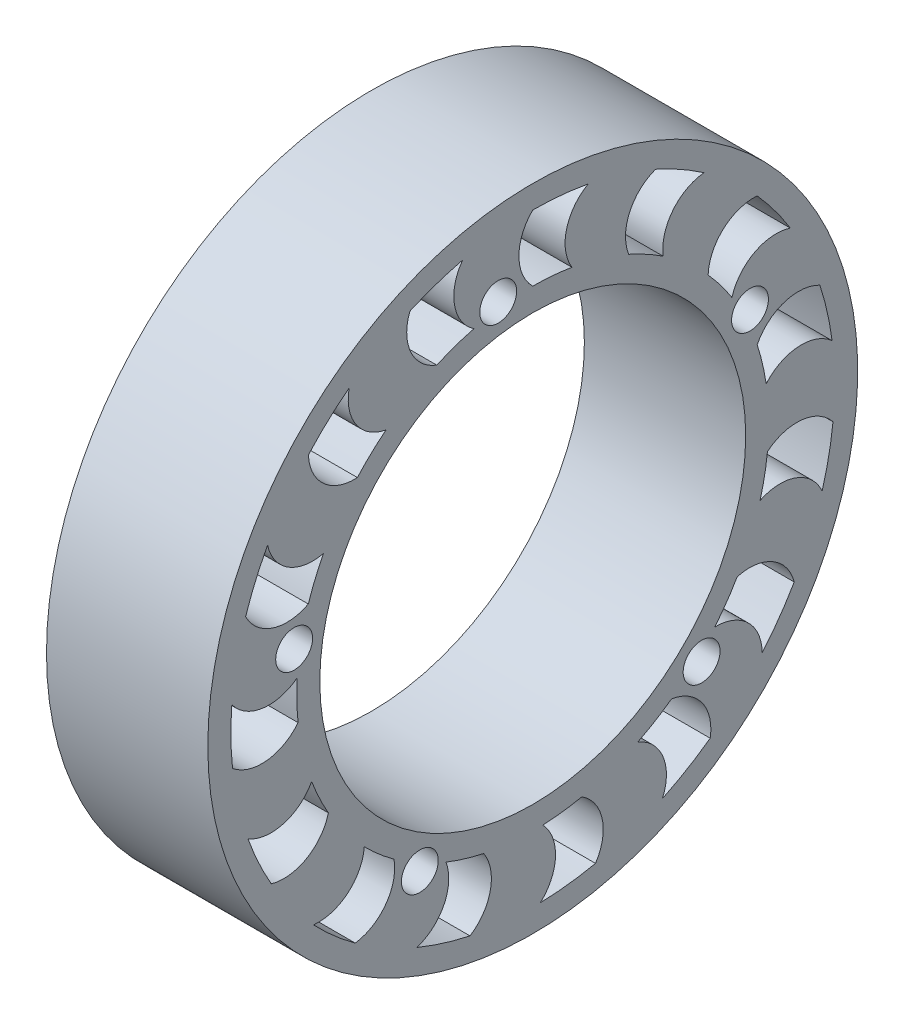
from build123d import *

# Parameters (mm, degrees)
SKETCH1_W             = 35
SKETCH1_H             = 5
SKETCH7_R             = 46.2
REINFORCEMENT_DEPTH   = 35
SKETCH8_R             = 4
INSERTS_HOLES_A_DEPTH = 12.7


with BuildPart() as part:
    # Sketch1 → Body (revolve)
    with BuildSketch(Plane(origin=(0, 0, 0), x_dir=(1, 0, 0), z_dir=(0, 1, 0)), mode=Mode.PRIVATE) as body_sk:
        with Locations((0, 68)):
            Rectangle(SKETCH1_W, SKETCH1_H)
    revolve(body_sk.sketch.rotate(Axis((-1000, 0, 0), (1, 0, 0)), 180), axis=Axis((-1000, 0, 0), (1, 0, 0)))

    # Sketch7 → Reinforcement (add)
    with BuildSketch(Plane.ZY.offset(-17.5)):
        with BuildLine():
            ThreePointArc((15.227788826, 63.705293716), (7.666591863, 65.049776089), (0, 65.5))
            ThreePointArc((0, 65.5), (3.008755476, 58.35), (0, 51.2))
            ThreePointArc((0, 51.2), (-4.264821355, 51.022066783), (-8.5, 50.48950386))
            ThreePointArc((-8.5, 50.48950386), (-7.314547286, 58.179485578), (-12, 64.391381411))
            ThreePointArc((-12, 64.391381411), (-19.454347387, 62.544211305), (-26.641250121, 59.837227476))
            ThreePointArc((-26.641250121, 59.837227476), (-20.984448226, 54.529148555), (-20.824916125, 46.773527431))
            ThreePointArc((-20.824916125, 46.773527431), (-24.648652343, 44.876318228), (-28.3010677, 42.667195444))
            ThreePointArc((-28.3010677, 42.667195444), (-30.345900107, 50.17451037), (-37.15287981, 53.943614282))
            ThreePointArc((-37.15287981, 53.943614282), (-43.211453237, 49.22418419), (-48.675986069, 43.828054717))
            ThreePointArc((-48.675986069, 43.828054717), (-41.349250191, 41.279711944), (-38.049015064, 34.259487046))
            ThreePointArc((-38.049015064, 34.259487046), (-40.770507414, 30.971046563), (-43.208623688, 27.467341316))
            ThreePointArc((-43.208623688, 27.467341316), (-48.130171117, 33.493906497), (-55.881689177, 34.168506182))
            ThreePointArc((-55.881689177, 34.168506182), (-59.496906258, 27.392848441), (-62.294201817, 20.240613132))
            ThreePointArc((-62.294201817, 20.240613132), (-54.564391152, 20.892638123), (-48.694093634, 15.821670112))
            ThreePointArc((-48.694093634, 15.821670112), (-49.842771366, 11.710599583), (-50.645016102, 7.518134342))
            ThreePointArc((-50.645016102, 7.518134342), (-57.592298291, 11.021901908), (-64.948046817, 8.485352952))
            ThreePointArc((-64.948046817, 8.485352952), (-65.494803675, 0.82504034), (-65.141184147, -6.846614344))
            ThreePointArc((-65.141184147, -6.846614344), (-58.344853181, -3.106962633), (-50.919521043, -5.351857319))
            ThreePointArc((-50.919521043, -5.351857319), (-50.29676734, -9.574716451), (-49.324425137, -13.73102636))
            ThreePointArc((-49.324425137, -13.73102636), (-57.096193882, -13.355889651), (-62.784297127, -18.664994891))
            ThreePointArc((-62.784297127, -18.664994891), (-60.168054535, -25.88542473), (-56.724663948, -32.75))
            ThreePointArc((-56.724663948, -32.75), (-52.036960049, -26.569341324), (-44.340500674, -25.6))
            ThreePointArc((-44.340500674, -25.6), (-42.05399531, -29.204477028), (-39.475192967, -32.605967862))
            ThreePointArc((-39.475192967, -32.605967862), (-46.727638847, -35.424326556), (-49.764572087, -42.587995551))
            ThreePointArc((-49.764572087, -42.587995551), (-44.437702156, -48.120064704), (-38.499934025, -52.990613132))
            ThreePointArc((-38.499934025, -52.990613132), (-36.731403783, -45.437639525), (-30.094604917, -41.421670112))
            ThreePointArc((-30.094604917, -41.421670112), (-26.539705442, -43.784518212), (-22.800341312, -45.843041305))
            ThreePointArc((-22.800341312, -45.843041305), (-28.279450549, -51.367575579), (-28.140100436, -59.14714488))
            ThreePointArc((-28.140100436, -59.14714488), (-21.023667371, -62.034308332), (-13.618215749, -64.068667848))
            ThreePointArc((-13.618215749, -64.068667848), (-15.074654109, -56.449357065), (-10.64507857, -50.081157158))
            ThreePointArc((-10.64507857, -50.081157158), (-6.436459398, -50.793818427), (-2.18310351, -51.153436435))
            ThreePointArc((-2.18310351, -51.153436435), (-4.94148834, -58.428904124), (-1.649949774, -65.479215525))
            ThreePointArc((-1.649949774, -65.479215525), (6.025550497, -65.222256487), (13.618215749, -64.068667848))
            ThreePointArc((13.618215749, -64.068667848), (9.18864021, -57.700467941), (10.64507857, -50.081157158))
            ThreePointArc((10.64507857, -50.081157158), (14.77970895, -49.020405989), (18.811612722, -47.618937691))
            ThreePointArc((18.811612722, -47.618937691), (19.250902095, -55.387344337), (25.125492192, -60.489334945))
            ThreePointArc((25.125492192, -60.489334945), (32.032895944, -57.132683969), (38.499934025, -52.990613132))
            ThreePointArc((38.499934025, -52.990613132), (31.86313516, -48.974643718), (30.094604917, -41.421670112))
            ThreePointArc((30.094604917, -41.421670112), (33.440331351, -38.770920019), (36.553630216, -35.850692016))
            ThreePointArc((36.553630216, -35.850692016), (40.114636669, -42.768809535), (47.556508301, -45.040298825))
            ThreePointArc((47.556508301, -45.040298825), (52.501462672, -39.164351358), (56.724663948, -32.75))
            ThreePointArc((56.724663948, -32.75), (49.028204573, -31.780658676), (44.340500674, -25.6))
            ThreePointArc((44.340500674, -25.6), (46.318816665, -21.817589755), (47.975192967, -17.883535998))
            ThreePointArc((47.975192967, -17.883535998), (54.042186133, -22.755159023), (61.764572087, -21.80338586))
            ThreePointArc((61.764572087, -21.80338586), (63.892049543, -14.424146601), (65.141184147, -6.846614344))
            ThreePointArc((65.141184147, -6.846614344), (57.715852009, -9.09150903), (50.919521043, -5.351857319))
            ThreePointArc((50.919521043, -5.351857319), (51.188357785, -1.091800016), (51.101409013, 3.175845861))
            ThreePointArc((51.101409013, 3.175845861), (58.625350656, 1.193065209), (65.292980245, 5.203530598))
            ThreePointArc((65.292980245, 5.203530598), (64.235120607, 12.810124142), (62.294201817, 20.240613132))
            ThreePointArc((62.294201817, 20.240613132), (56.4239043, 15.169645121), (48.694093634, 15.821670112))
            ThreePointArc((48.694093634, 15.821670112), (47.206966812, 19.822771865), (45.391727198, 23.686095119))
            ThreePointArc((45.391727198, 23.686095119), (53.071659457, 24.934997627), (57.531638952, 31.310709343))
            ThreePointArc((57.531638952, 31.310709343), (53.471355761, 37.829408046), (48.675986069, 43.828054717))
            ThreePointArc((48.675986069, 43.828054717), (45.375750942, 36.807829818), (38.049015064, 34.259487046))
            ThreePointArc((38.049015064, 34.259487046), (35.063062416, 37.309806406), (31.83340338, 40.100803349))
            ThreePointArc((31.83340338, 40.100803349), (38.341396196, 44.365442429), (39.822554625, 52.003981993))
            ThreePointArc((39.822554625, 52.003981993), (33.461907731, 56.307643628), (26.641250121, 59.837227476))
            ThreePointArc((26.641250121, 59.837227476), (26.481718021, 52.081606351), (20.824916125, 46.773527431))
            ThreePointArc((20.824916125, 46.773527431), (16.856435989, 48.34563647), (12.770794921, 49.581718376))
            ThreePointArc((12.770794921, 49.581718376), (16.981557213, 56.124699187), (15.227788826, 63.705293716))
        make_face()
        with Locations(Location((0, 0, 0), (0, 0, 180))):
            Circle(SKETCH7_R, mode=Mode.SUBTRACT)
    extrude(amount=REINFORCEMENT_DEPTH)

    # Sketch8 → Inserts_Holes_A (cut)
    with BuildSketch(Plane.ZY.offset(17.5)):
        with Locations((7.5, 52)):
            Circle(SKETCH8_R)
        with Locations((51.772566305, 8.935959835)):
            Circle(SKETCH8_R)
        with Locations((24.497205661, -46.4772731)):
            Circle(SKETCH8_R)
        with Locations((-36.632460577, -37.660494315)):
            Circle(SKETCH8_R)
        with Locations((-47.13731139, 23.20180758)):
            Circle(SKETCH8_R)
    inserts_holes_a = extrude(amount=-INSERTS_HOLES_A_DEPTH, mode=Mode.SUBTRACT)

    # Mirror1: Inserts_Holes_A across plane
    add(inserts_holes_a.mirror(Plane(origin=(0, 0, 0), x_dir=(0, 0, 1), z_dir=(1, 0, 0))), mode=Mode.SUBTRACT)


solid = part.part
